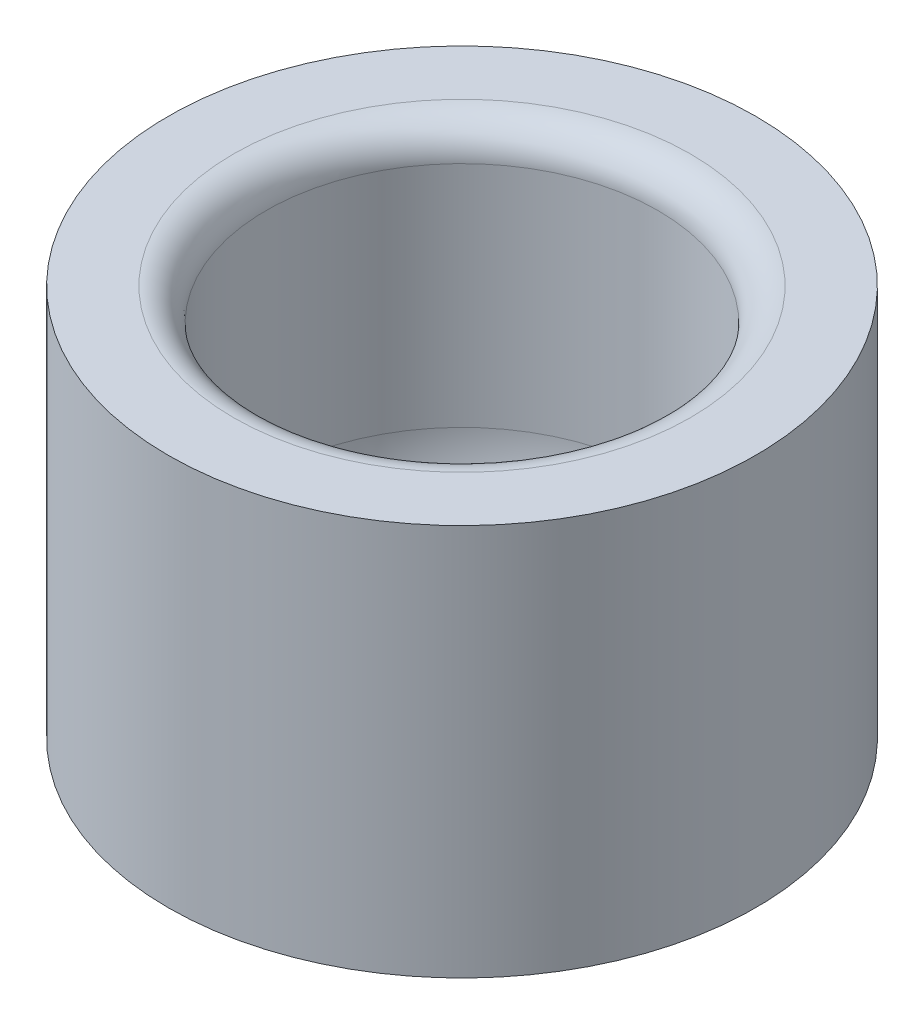
from build123d import *

# Parameters (mm, degrees)
SKETCH1_R           = 9
BOSS_EXTRUDE1_DEPTH = 16.4
SKETCH2_W           = 6
SKETCH2_H           = 13
FILLET1_R           = 5
FILLET2_R           = 1


with BuildPart() as part:
    # Sketch1 → Boss-Extrude1 (new body)
    with BuildSketch(Plane(origin=(0, 0, 0), x_dir=(1, 0, 0), z_dir=(0, 1, 0))):
        with Locations(Location((0, 0, 0), (0, 0, 270))):
            Circle(SKETCH1_R)
    extrude(amount=BOSS_EXTRUDE1_DEPTH)

    # Sketch2 → Ø12.0mm Dowel Hole1 (revolve, cut)
    with BuildSketch(Plane(origin=(0, 16.4, 0), x_dir=(0, 0, 1), z_dir=(1, 0, 0))):
        with Locations((3, 6.5)):
            Rectangle(SKETCH2_W, SKETCH2_H)
    revolve(axis=Axis((0, 19.332571692, 0), (0, -1, 0)), mode=Mode.SUBTRACT)

    # Sketch3 → Cut-Revolve1 (revolve, cut)
    with BuildSketch(Plane(origin=(0, 0, 0), x_dir=(0, 0, -1), z_dir=(1, 0, 0))):
        Polygon((-9, 0), (-1.686427948, 0), (-9, 4.39443743), align=None)
    revolve(axis=Axis((0, 0, 0), (0, 1, 0)), mode=Mode.SUBTRACT)

    # Fillet1
    fillet1_edges = [part.edges().sort_by_distance(p)[0] for p in [
        (0, 3.4, -6),
    ]]
    fillet(fillet1_edges, radius=FILLET1_R)

    # Fillet2
    fillet2_edges = [part.edges().sort_by_distance(p)[0] for p in [
        (0, 16.4, -6),
    ]]
    fillet(fillet2_edges, radius=FILLET2_R)


solid = part.part
